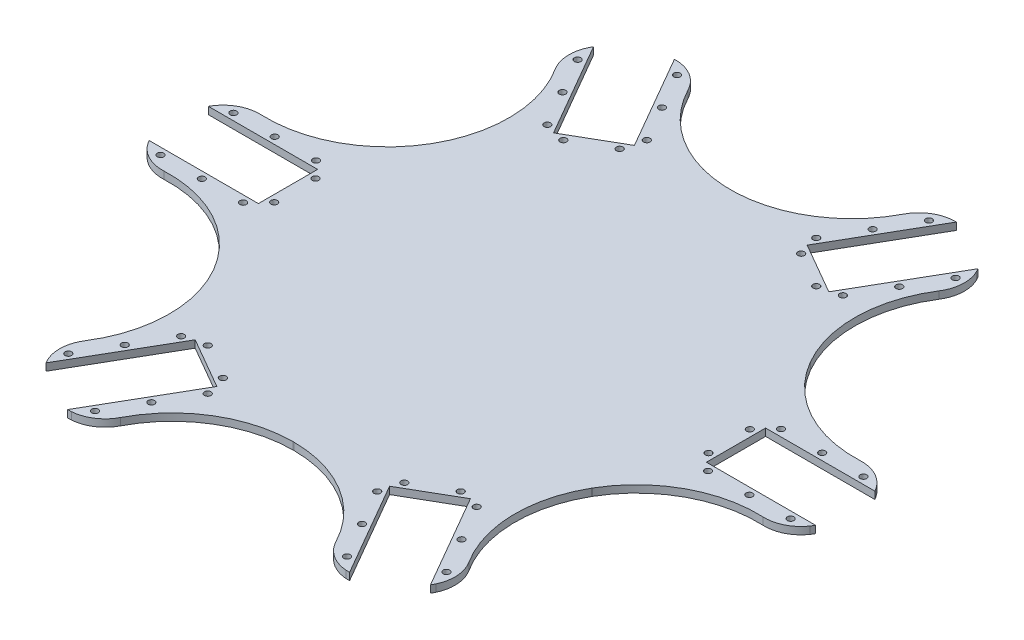
from build123d import *

# Parameters (mm, degrees)
SKETCH2_R           = 1.35
BOSS_EXTRUDE1_DEPTH = 3
CIRPATTERN1_COUNT   = 6
CUT_EXTRUDE3_DEPTH  = 5
CUT_EXTRUDE9_DEPTH  = 10


with BuildPart() as part:
    # Sketch2 → Boss-Extrude1 (new body)
    with BuildSketch(Plane(origin=(0, 0, 0), x_dir=(1, 0, 0), z_dir=(0, 1, 0))):
        Polygon((0, 125), (-58.08143708, 125), (-35.58143708, 86.02885683), (-56.712456933, 73.82885683), (-79.212456933, 112.8), (-108.253175473, 62.5), (0, 0), align=None)
        with Locations(Location((-37.385731074, 81.753985699, 0), (0, 0, 270))):
            Circle(SKETCH2_R, mode=Mode.SUBTRACT)
        with Locations(Location((-52.108162939, 73.253985699, 0), (0, 0, 270))):
            Circle(SKETCH2_R, mode=Mode.SUBTRACT)
        with Locations(Location((-60.887328063, 75.459945743, 0), (0, 0, 270))):
            Circle(SKETCH2_R, mode=Mode.SUBTRACT)
        with Locations(Location((-34.90656595, 90.459945743, 0), (0, 0, 270))):
            Circle(SKETCH2_R, mode=Mode.SUBTRACT)
        with Locations(Location((-51.90656595, 119.904809472, 0), (0, 0, 270))):
            Circle(SKETCH2_R, mode=Mode.SUBTRACT)
        with Locations(Location((-43.40656595, 105.182377607, 0), (0, 0, 270))):
            Circle(SKETCH2_R, mode=Mode.SUBTRACT)
        with Locations(Location((-69.387328063, 90.182377607, 0), (0, 0, 270))):
            Circle(SKETCH2_R, mode=Mode.SUBTRACT)
        with Locations(Location((-77.887328063, 104.904809472, 0), (0, 0, 270))):
            Circle(SKETCH2_R, mode=Mode.SUBTRACT)
    boss_extrude1 = extrude(amount=BOSS_EXTRUDE1_DEPTH)

    # CirPattern1: Boss-Extrude1 ×6 about axis
    cirpattern1_axis = Axis((0, 0, 0), (0, 1, 0))
    for i in range(1, CIRPATTERN1_COUNT):
        add(boss_extrude1.rotate(cirpattern1_axis, i * 360 / CIRPATTERN1_COUNT))

    # Sketch4 → Cut-Extrude3 (cut)
    with BuildSketch(Plane(origin=(0, 3, 0), x_dir=(1, 0, 0), z_dir=(0, 1, 0))):
        with BuildLine():
            Line((79.212456933, -112.8), (137.293894013, -12.2))
            ThreePointArc((137.293894013, -12.2), (125.5592118, -23.716902798), (109.56410095, -27.524558982))
            ThreePointArc((109.56410095, -27.524558982), (77.942286341, -45), (78.619017782, -81.123015275))
            ThreePointArc((78.619017782, -81.123015275), (83.319046223, -96.879015699), (79.212456933, -112.8))
        make_face()
        with BuildLine():
            Line((137.293894013, 12.2), (79.212456933, 112.8))
            ThreePointArc((79.212456933, 112.8), (83.319046223, 96.879015699), (78.619017782, 81.123015275))
            ThreePointArc((78.619017782, 81.123015275), (77.942286341, 45), (109.56410095, 27.524558982))
            ThreePointArc((109.56410095, 27.524558982), (125.5592118, 23.716902798), (137.293894013, 12.2))
        make_face()
        with BuildLine():
            Line((58.08143708, 125), (-58.08143708, 125))
            ThreePointArc((-58.08143708, 125), (-42.240165578, 120.595918497), (-30.945083169, 108.647574257))
            ThreePointArc((-30.945083169, 108.647574257), (0, 90), (30.945083169, 108.647574257))
            ThreePointArc((30.945083169, 108.647574257), (42.240165578, 120.595918497), (58.08143708, 125))
        make_face()
        with BuildLine():
            Line((-79.212456933, 112.8), (-137.293894013, 12.2))
            ThreePointArc((-137.293894013, 12.2), (-125.5592118, 23.716902798), (-109.56410095, 27.524558982))
            ThreePointArc((-109.56410095, 27.524558982), (-77.942286341, 45), (-78.619017782, 81.123015275))
            ThreePointArc((-78.619017782, 81.123015275), (-83.319046223, 96.879015699), (-79.212456933, 112.8))
        make_face()
        with BuildLine():
            Line((-137.293894013, -12.2), (-79.212456933, -112.8))
            ThreePointArc((-79.212456933, -112.8), (-83.319046223, -96.879015699), (-78.619017782, -81.123015275))
            ThreePointArc((-78.619017782, -81.123015275), (-77.942286341, -45), (-109.56410095, -27.524558982))
            ThreePointArc((-109.56410095, -27.524558982), (-125.5592118, -23.716902798), (-137.293894013, -12.2))
        make_face()
        with BuildLine():
            Line((-58.08143708, -125), (58.08143708, -125))
            ThreePointArc((58.08143708, -125), (42.240165578, -120.595918497), (30.945083169, -108.647574257))
            ThreePointArc((30.945083169, -108.647574257), (0, -90), (-30.945083169, -108.647574257))
            ThreePointArc((-30.945083169, -108.647574257), (-42.240165578, -120.595918497), (-58.08143708, -125))
        make_face()
    extrude(amount=-CUT_EXTRUDE3_DEPTH, mode=Mode.SUBTRACT)

    # Sketch8 → Cut-Extrude9 (cut)
    with BuildSketch(Plane(origin=(0, 3, 0), x_dir=(1, 0, 0), z_dir=(0, 1, 0))):
        with BuildLine():
            Line((-79.627397697, 112.081427342), (-137.090413308, 12.563994028))
            ThreePointArc((-137.090413308, 12.563994028), (-131.312677504, 18.215244412), (-123.44128918, 20.048304088))
            ThreePointArc((-123.44128918, 20.048304088), (-77.942300503, 45.000018775), (-79.083064161, 96.879154221))
            ThreePointArc((-79.083064161, 96.879154221), (-81.425302856, 104.406169658), (-79.627397697, 112.081427342))
        make_face()
        with BuildLine():
            Line((-136.879097611, -12.918653567), (-79.425980046, -112.441801521))
            ThreePointArc((-79.425980046, -112.441801521), (-81.43123854, -104.612510346), (-79.083020624, -96.879158257))
            ThreePointArc((-79.083020624, -96.879158257), (-77.942345072, -45.000020873), (-123.441376125, -20.048383457))
            ThreePointArc((-123.441376125, -20.048383457), (-131.131082054, -18.31331395), (-136.879097611, -12.918653567))
        make_face()
        with BuildLine():
            Line((-57.251702025, -125.000120556), (57.66443115, -125.005835196))
            ThreePointArc((57.66443115, -125.005835196), (49.881436852, -122.827794405), (44.358266444, -116.927501992))
            ThreePointArc((44.358266444, -116.927501992), (-4.6681e-05, -90.000079294), (-44.358314075, -116.927577326))
            ThreePointArc((-44.358314075, -116.927577326), (-49.70578131, -122.719523255), (-57.251702025, -125.000120556))
        make_face()
        with BuildLine():
            Line((79.627393474, -112.081506636), (137.090409084, -12.564073322))
            ThreePointArc((137.090409084, -12.564073322), (131.312673281, -18.215323706), (123.441284957, -20.048383382))
            ThreePointArc((123.441284957, -20.048383382), (77.94229628, -45.000098069), (79.083059938, -96.879233516))
            ThreePointArc((79.083059938, -96.879233516), (81.425298632, -104.406248952), (79.627393474, -112.081506636))
        make_face()
        with BuildLine():
            Line((136.879093387, 12.918574273), (79.425975823, 112.441722226))
            ThreePointArc((79.425975823, 112.441722226), (81.431234317, 104.612431052), (79.083016401, 96.879078963))
            ThreePointArc((79.083016401, 96.879078963), (77.942340849, 44.999941578), (123.441371902, 20.048304163))
            ThreePointArc((123.441371902, 20.048304163), (131.131077831, 18.313234656), (136.879093387, 12.918574273))
        make_face()
        with BuildLine():
            Line((57.251697801, 125.000041262), (-57.664435373, 125.005755901))
            ThreePointArc((-57.664435373, 125.005755901), (-49.881441076, 122.827715111), (-44.358270668, 116.927422698))
            ThreePointArc((-44.358270668, 116.927422698), (4.2458e-05, 90), (44.358309852, 116.927498031))
            ThreePointArc((44.358309852, 116.927498031), (49.705777087, 122.71944396), (57.251697801, 125.000041262))
        make_face()
    extrude(amount=-CUT_EXTRUDE9_DEPTH, mode=Mode.SUBTRACT)


solid = part.part
